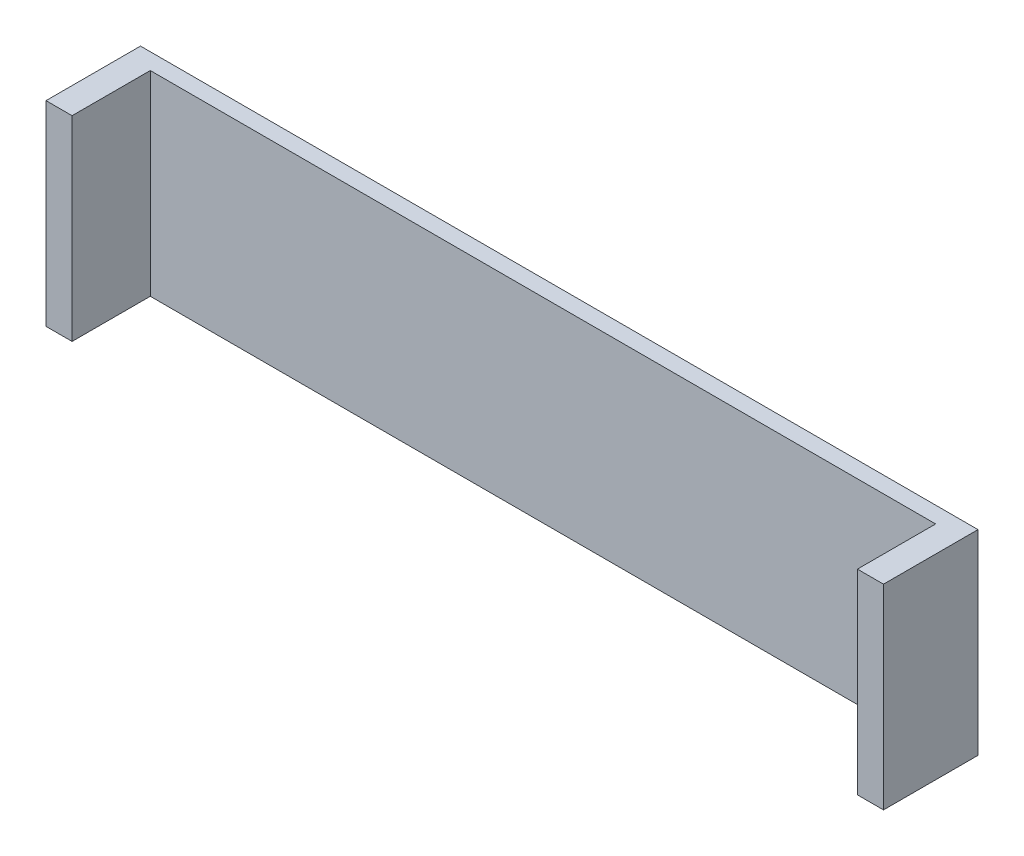
from build123d import *

# Parameters (mm, degrees)
SKETCH_2_W        = 8
SKETCH_2_H        = 60
EXTRUDE_1_DEPTH   = 24
EXTRUDE_1_2_DEPTH = 24
SKETCH_3_W        = 257
SKETCH_3_H        = 60
EXTRUDE_2_DEPTH   = 5


with BuildPart() as part:
    # 草图2 → 凸台-拉伸1 (new body)
    with BuildSketch(Plane.XY):
        with Locations((-19.51681736, 5.547854677)):
            Rectangle(SKETCH_2_W, SKETCH_2_H)
    extrude(amount=EXTRUDE_1_DEPTH)



with BuildPart() as body_2:
    # 草图2 → Extrude 1 2 (new body)
    with BuildSketch(Plane.XY):
        with Locations((229.48318264, 5.547854677)):
            Rectangle(SKETCH_2_W, SKETCH_2_H)
    extrude(amount=EXTRUDE_1_2_DEPTH)


with BuildPart() as part_1:
    add(part.part)

    add(body_2.part)  # 凸台-拉伸2 merges body 2
    # 草图3 → 凸台-拉伸2 (add)
    with BuildSketch(Plane(origin=(0, 0, 0), x_dir=(-1, 0, 0), z_dir=(0, 0, -1))):
        with Locations((-104.98318264, 5.547854677)):
            Rectangle(SKETCH_3_W, SKETCH_3_H)
    extrude(amount=EXTRUDE_2_DEPTH)


solid = part_1.part
